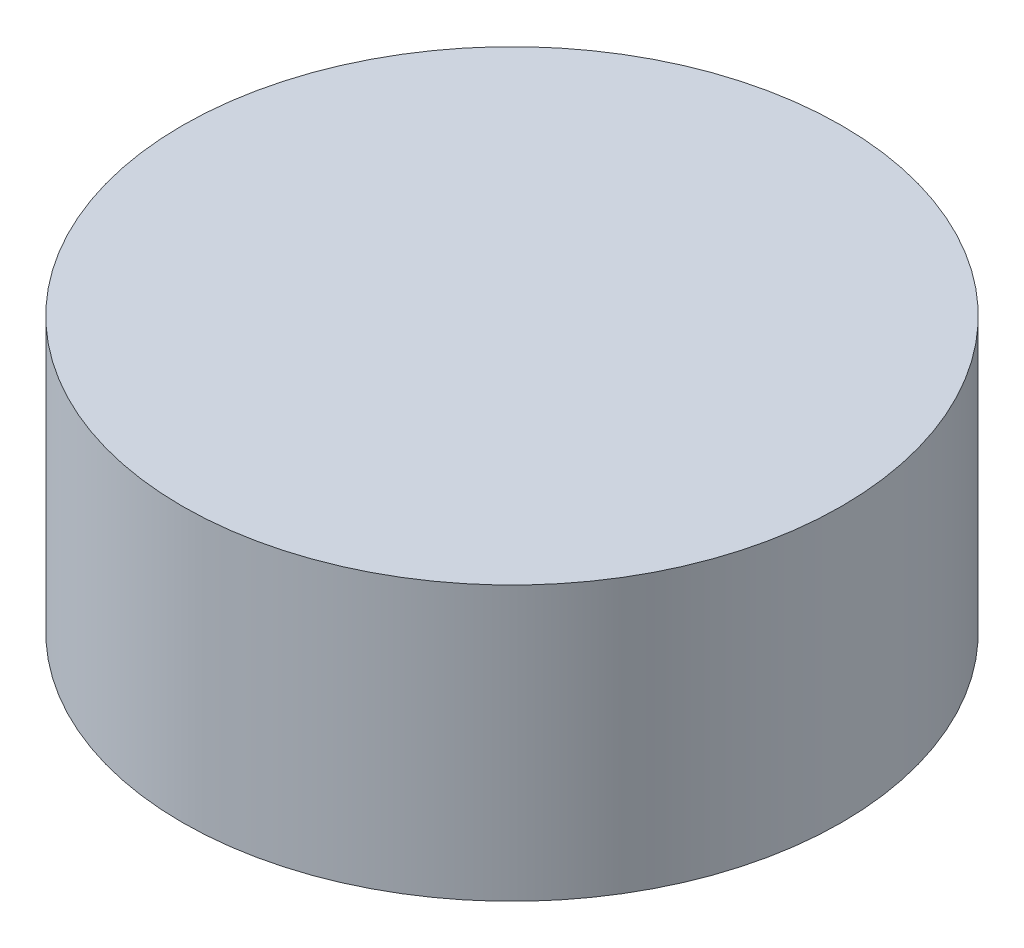
from build123d import *

# Parameters (mm, degrees)
SKETCH_1_R      = 32.5
EXTRUDE_1_DEPTH = 27


with BuildPart() as part:
    # 草图1 → 凸台-拉伸1 (new body)
    with BuildSketch(Plane(origin=(0, 0, 0), x_dir=(1, 0, 0), z_dir=(0, 1, 0))):
        with Locations(Location((0, 0, 0), (0, 0, 270))):
            Circle(SKETCH_1_R)
    extrude(amount=EXTRUDE_1_DEPTH)


solid = part.part
